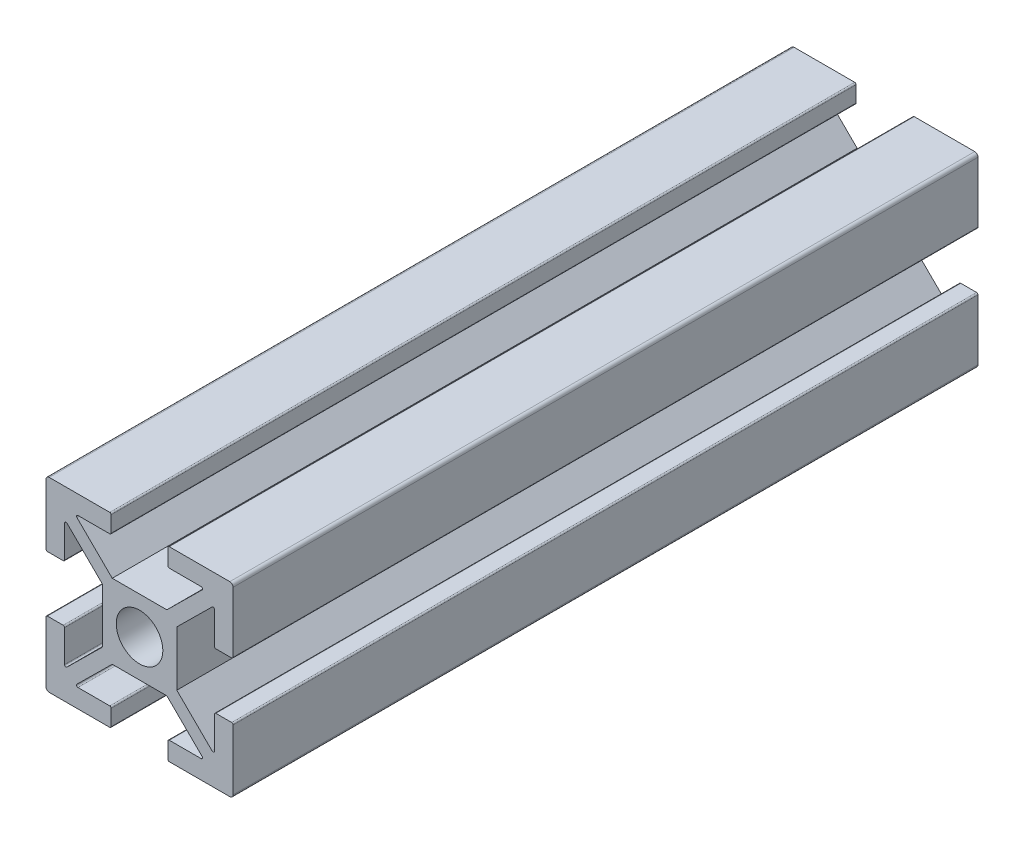
from build123d import *

# Parameters (mm, degrees)
SKETCH1_R           = 2.5
BOSS_EXTRUDE1_DEPTH = 80


with BuildPart() as part:
    # Sketch1 → Boss-Extrude1 (new body)
    with BuildSketch(Plane.XY):
        with BuildLine():
            Line((-7.427382464, 2.155691805), (-5.727382464, 2.155691805))
            ThreePointArc((-5.727382464, 2.155691805), (-5.621316447, 2.199625788), (-5.577382464, 2.305691805))
            Line((-5.577382464, 2.305691805), (-5.577382464, 5.741876319))
            ThreePointArc((-5.577382464, 5.741876319), (-5.485183419, 5.880292537), (-5.321928469, 5.848550846))
            Line((-5.321928469, 5.848550846), (-1.531086168, 2.101082027))
            Line((-1.531086168, 2.101082027), (-1.531086168, -3.789698417))
            Line((-1.531086168, -3.789698417), (-5.321928469, -7.537167236))
            ThreePointArc((-5.321928469, -7.537167236), (-5.485183419, -7.568908927), (-5.577382464, -7.430492708))
            Line((-5.577382464, -7.430492708), (-5.577382464, -3.994308195))
            ThreePointArc((-5.577382464, -3.994308195), (-5.621316447, -3.888242178), (-5.727382464, -3.844308195))
            Line((-5.727382464, -3.844308195), (-7.427382464, -3.844308195))
            ThreePointArc((-7.427382464, -3.844308195), (-7.533448481, -3.888242178), (-7.577382464, -3.994308195))
            Line((-7.577382464, -3.994308195), (-7.577382464, -10.494308195))
            ThreePointArc((-7.577382464, -10.494308195), (-7.474869837, -10.741795568), (-7.227382464, -10.844308195))
            Line((-7.227382464, -10.844308195), (-0.727382464, -10.844308195))
            ThreePointArc((-0.727382464, -10.844308195), (-0.621316447, -10.800374212), (-0.577382464, -10.694308195))
            Line((-0.577382464, -10.694308195), (-0.577382464, -8.994308195))
            ThreePointArc((-0.577382464, -8.994308195), (-0.621316447, -8.888242178), (-0.727382464, -8.844308195))
            Line((-0.727382464, -8.844308195), (-4.145467261, -8.844308195))
            ThreePointArc((-4.145467261, -8.844308195), (-4.284213755, -8.751311795), (-4.250921257, -8.587633667))
            Line((-4.250921257, -8.587633667), (-0.464270258, -4.844308195))
            Line((-0.464270258, -4.844308195), (5.402097922, -4.844308195))
            Line((5.402097922, -4.844308195), (9.188748921, -8.587633667))
            ThreePointArc((9.188748921, -8.587633667), (9.22204142, -8.751311795), (9.083294926, -8.844308195))
            Line((9.083294926, -8.844308195), (5.665210129, -8.844308195))
            ThreePointArc((5.665210129, -8.844308195), (5.559144111, -8.888242178), (5.515210129, -8.994308195))
            Line((5.515210129, -8.994308195), (5.515210129, -10.694308195))
            ThreePointArc((5.515210129, -10.694308195), (5.559144111, -10.800374212), (5.665210129, -10.844308195))
            Line((5.665210129, -10.844308195), (12.165210129, -10.844308195))
            ThreePointArc((12.165210129, -10.844308195), (12.412697502, -10.741795568), (12.515210129, -10.494308195))
            Line((12.515210129, -10.494308195), (12.515210129, -3.994308195))
            ThreePointArc((12.515210129, -3.994308195), (12.471276146, -3.888242178), (12.365210129, -3.844308195))
            Line((12.365210129, -3.844308195), (10.665210129, -3.844308195))
            ThreePointArc((10.665210129, -3.844308195), (10.559144111, -3.888242178), (10.515210129, -3.994308195))
            Line((10.515210129, -3.994308195), (10.515210129, -7.430492708))
            ThreePointArc((10.515210129, -7.430492708), (10.423011083, -7.568908927), (10.259756133, -7.537167236))
            Line((10.259756133, -7.537167236), (6.468913832, -3.789698417))
            Line((6.468913832, -3.789698417), (6.468913832, 2.101082027))
            Line((6.468913832, 2.101082027), (10.259756133, 5.848550846))
            ThreePointArc((10.259756133, 5.848550846), (10.423011083, 5.880292537), (10.515210129, 5.741876319))
            Line((10.515210129, 5.741876319), (10.515210129, 2.305691805))
            ThreePointArc((10.515210129, 2.305691805), (10.559144111, 2.199625788), (10.665210129, 2.155691805))
            Line((10.665210129, 2.155691805), (12.365210129, 2.155691805))
            ThreePointArc((12.365210129, 2.155691805), (12.471276146, 2.199625788), (12.515210129, 2.305691805))
            Line((12.515210129, 2.305691805), (12.515210129, 8.805691805))
            ThreePointArc((12.515210129, 8.805691805), (12.412697502, 9.053179179), (12.165210129, 9.155691805))
            Line((12.165210129, 9.155691805), (5.665210129, 9.155691805))
            ThreePointArc((5.665210129, 9.155691805), (5.559144111, 9.111757822), (5.515210129, 9.005691805))
            Line((5.515210129, 9.005691805), (5.515210129, 7.305691805))
            ThreePointArc((5.515210129, 7.305691805), (5.559144111, 7.199625788), (5.665210129, 7.155691805))
            Line((5.665210129, 7.155691805), (9.083294926, 7.155691805))
            ThreePointArc((9.083294926, 7.155691805), (9.22204142, 7.062695405), (9.188748921, 6.899017277))
            Line((9.188748921, 6.899017277), (5.402097922, 3.155691805))
            Line((5.402097922, 3.155691805), (-0.464270258, 3.155691805))
            Line((-0.464270258, 3.155691805), (-4.250921257, 6.899017277))
            ThreePointArc((-4.250921257, 6.899017277), (-4.284213755, 7.062695405), (-4.145467261, 7.155691805))
            Line((-4.145467261, 7.155691805), (-0.727382464, 7.155691805))
            ThreePointArc((-0.727382464, 7.155691805), (-0.621316447, 7.199625788), (-0.577382464, 7.305691805))
            Line((-0.577382464, 7.305691805), (-0.577382464, 9.005691805))
            ThreePointArc((-0.577382464, 9.005691805), (-0.621316447, 9.111757822), (-0.727382464, 9.155691805))
            Line((-0.727382464, 9.155691805), (-7.227382464, 9.155691805))
            ThreePointArc((-7.227382464, 9.155691805), (-7.474869837, 9.053179179), (-7.577382464, 8.805691805))
            Line((-7.577382464, 8.805691805), (-7.577382464, 2.305691805))
            ThreePointArc((-7.577382464, 2.305691805), (-7.533448481, 2.199625788), (-7.427382464, 2.155691805))
        make_face()
        with Locations((2.468913832, -0.844308195)):
            Circle(SKETCH1_R, mode=Mode.SUBTRACT)
    extrude(amount=BOSS_EXTRUDE1_DEPTH)


solid = part.part
